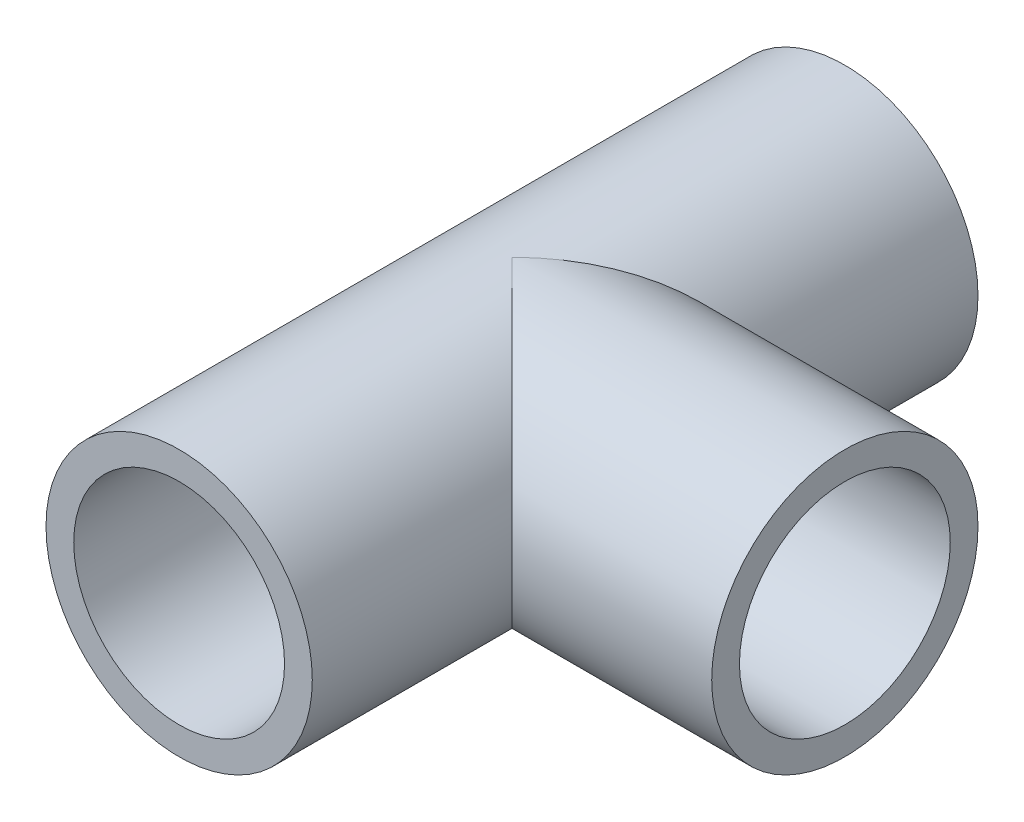
from build123d import *

# Parameters (mm, degrees)
SKETCH1_R                = 30.48
SKETCH1_R_2              = 24.13
BOSS_EXTRUDE1_DEPTH      = 152.4
BOSS_EXTRUDE2_REACH      = 190.508
BOSS_EXTRUDE2_END_RADIUS = 30.48
SKETCH2_R                = 30.48
SKETCH2_R_2              = 24.13


with BuildPart() as part:
    # Sketch1 → Boss-Extrude1 (new body)
    with BuildSketch(Plane.XY):
        with Locations(Location((0, 0, 0), (0, 0, 180))):
            Circle(SKETCH1_R)
        with Locations(Location((0, 0, 0), (0, 0, 180))):
            Circle(SKETCH1_R_2, mode=Mode.SUBTRACT)
    extrude(amount=BOSS_EXTRUDE1_DEPTH)

    # Boss-Extrude2: up to this cylinder (the profile starts outside it)
    boss_extrude2_end = Plane(origin=(0, 0, 105.817895), z_dir=(0, 0, -1)) * Cylinder(BOSS_EXTRUDE2_END_RADIUS, 442.976, mode=Mode.PRIVATE)
    # Sketch2 → Boss-Extrude2 (add, up to the surface)
    with BuildSketch(Plane(origin=(76.2, 0, 0), x_dir=(0, 0, -1), z_dir=(1, 0, 0)), mode=Mode.PRIVATE) as boss_extrude2_sk1:
        with Locations((-76.2, 0)):
            Circle(SKETCH2_R)
        with Locations((-76.2, 0)):
            Circle(SKETCH2_R_2, mode=Mode.SUBTRACT)
    boss_extrude2_tool1 = extrude(boss_extrude2_sk1.sketch, amount=-BOSS_EXTRUDE2_REACH, mode=Mode.PRIVATE) - boss_extrude2_end
    add(boss_extrude2_tool1.solids().sort_by_distance((76.2, 0, 105.817895))[0])


solid = part.part
